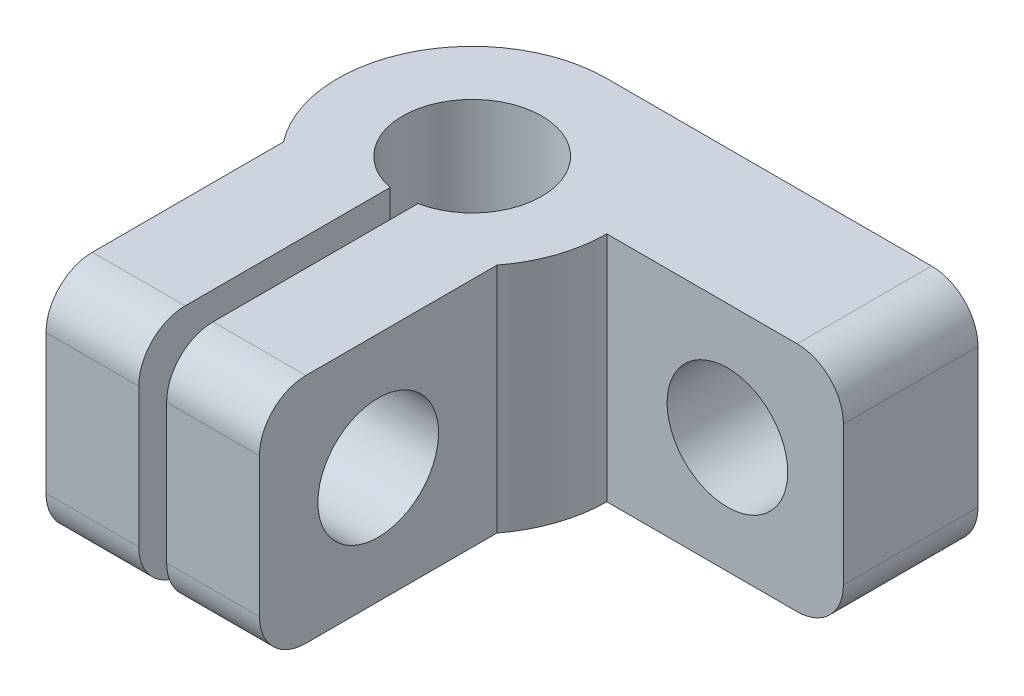
from build123d import *

# Parameters (mm, degrees)
BOSS_EXTRUDE1_DEPTH = 5
SKETCH2_R           = 1.3
CUT_EXTRUDE1_DEPTH  = 14.35984761
SKETCH3_R           = 1.3
CUT_EXTRUDE2_DEPTH  = 14.591735948
FILLET1_R           = 1
FILLET2_R           = 1


with BuildPart() as part:
    # Sketch1 → Boss-Extrude1 (new body)
    with BuildSketch(Plane(origin=(0, 0, 0), x_dir=(1, 0, 0), z_dir=(0, 1, 0))):
        with BuildLine():
            Line((2.3, -6.88444102), (2.3, -1.766352173))
            ThreePointArc((2.3, -1.766352173), (2.745906044, -0.932737905), (2.9, 0))
            Line((2.9, 0), (8, 0))
            Line((8, 0), (8, 2.9))
            Line((8, 2.9), (0, 2.9))
            ThreePointArc((0, 2.9), (-2.601194082, 1.282103486), (-2.3, -1.766352173))
            Line((-2.3, -1.766352173), (-2.3, -6.88444102))
            Line((-2.3, -6.88444102), (-0.3, -6.88444102))
            Line((-0.3, -6.88444102), (-0.3, -2.88444102))
            Line((-0.3, -2.88444102), (-0.3, -1.469693846))
            ThreePointArc((-0.3, -1.469693846), (0, 1.5), (0.3, -1.469693846))
            Line((0.3, -1.469693846), (0.3, -2.88444102))
            Line((0.3, -2.88444102), (0.3, -6.88444102))
            Line((0.3, -6.88444102), (2.3, -6.88444102))
        make_face()
    extrude(amount=BOSS_EXTRUDE1_DEPTH)

    # Sketch2 → Cut-Extrude1 (cut, through all)
    with BuildSketch(Plane.ZY.offset(2.3)):
        with Locations((4.325396597, 2.5)):
            Circle(SKETCH2_R)
    extrude(amount=-CUT_EXTRUDE1_DEPTH, mode=Mode.SUBTRACT)

    # Sketch3 → Cut-Extrude2 (cut, through all)
    with BuildSketch(Plane(origin=(0, 0, -2.9), x_dir=(-1, 0, 0), z_dir=(0, 0, -1))):
        with Locations((-5.5, 2.5)):
            Circle(SKETCH3_R)
    extrude(amount=-CUT_EXTRUDE2_DEPTH, mode=Mode.SUBTRACT)

    # Fillet1
    fillet1_edges = [part.edges().sort_by_distance(p)[0] for p in [
        (1.3, 0, 6.88444102),
        (-1.3, 0, 6.88444102),
        (-1.3, 5, 6.88444102),
        (1.3, 5, 6.88444102),
    ]]
    fillet(fillet1_edges, radius=FILLET1_R)

    # Fillet2
    fillet2_edges = [part.edges().sort_by_distance(p)[0] for p in [
        (8, 0, -1.45),
        (8, 5, -1.45),
    ]]
    fillet(fillet2_edges, radius=FILLET2_R)


solid = part.part
